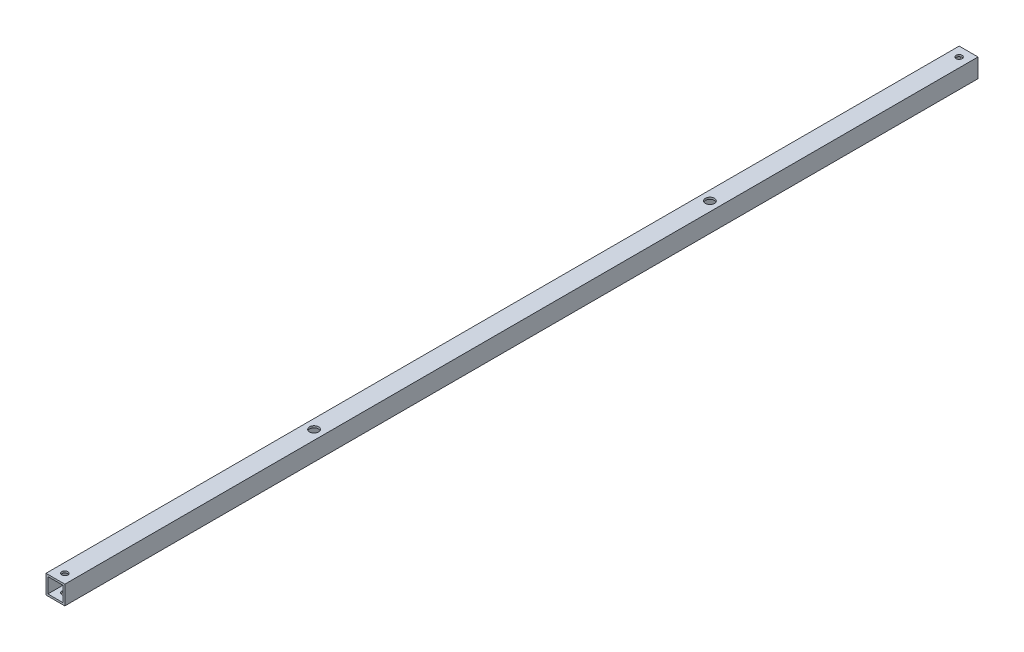
from build123d import *

# Parameters (mm, degrees)
SKETCH_1_W          = 10
SKETCH_1_H          = 10
SKETCH_1_W_2        = 8
SKETCH_1_H_2        = 8
EXTRUDE_1_DEPTH     = 242.228968082
SKETCH_2_R          = 2.4
SKETCH_2_R_2        = 1.6
CUT_EXTRUDE_1_DEPTH = 243.641449423


with BuildPart() as part:
    # ｽｹｯﾁ1 → ﾎﾞｽ - 押し出し1 (new body)
    with BuildSketch(Plane.XY):
        with Locations((5, 5)):
            Rectangle(SKETCH_1_W, SKETCH_1_H)
        with Locations((5, 5)):
            Rectangle(SKETCH_1_W_2, SKETCH_1_H_2, mode=Mode.SUBTRACT)
    extrude(amount=EXTRUDE_1_DEPTH)

    # ｽｹｯﾁ2 → ｶｯﾄ - 押し出し1 (cut, through all)
    with BuildSketch(Plane(origin=(0, 10, 0), x_dir=(1, 0, 0), z_dir=(0, 1, 0))):
        with Locations((5, -137.228968082)):
            Circle(SKETCH_2_R)
        with Locations((5, -5)):
            Circle(SKETCH_2_R_2)
    extrude(amount=-CUT_EXTRUDE_1_DEPTH, mode=Mode.SUBTRACT)

    # ﾐﾗｰ1: part across plane


with BuildPart() as part_1:
    add(part.part)
    add(part.part.mirror(Plane(origin=(0, 0, 242.228968082), x_dir=(1, 0, 0), z_dir=(0, 0, -1))))


solid = part_1.part
